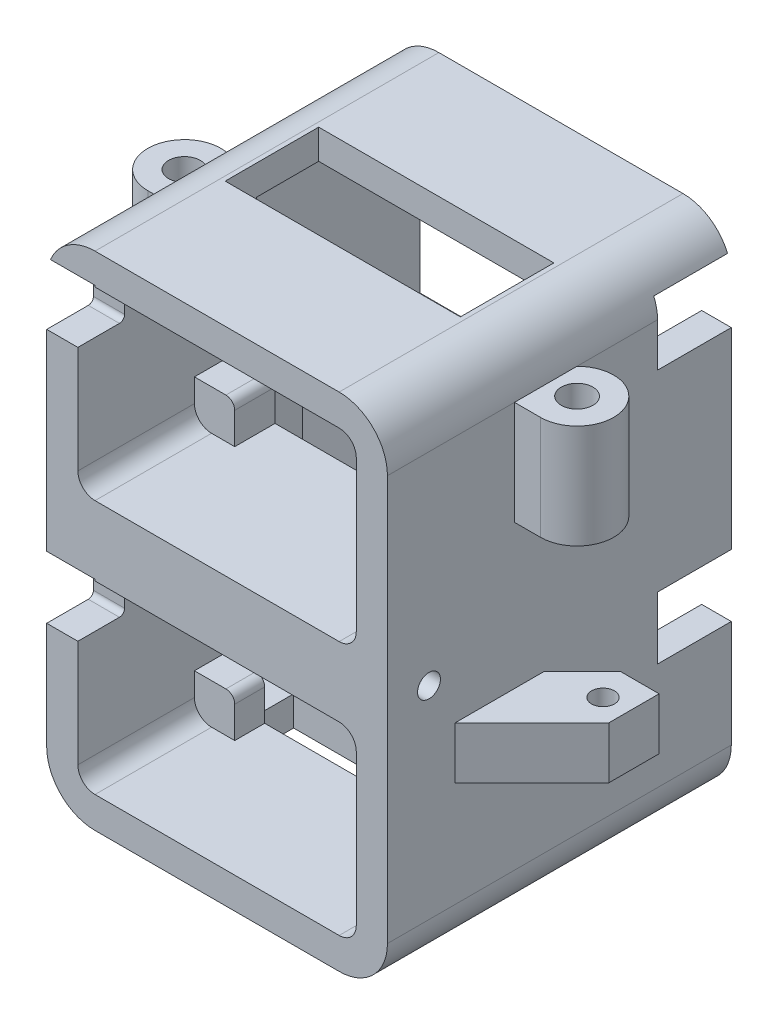
from build123d import *

# Parameters (mm, degrees)
EXTRUDE_2_DEPTH      = 11.22
EXTRUDE_3_DEPTH      = 3.88
CUT_EXTRUDE_1_DEPTH  = 4.65
SKETCH_8_R           = 3.525
SKETCH_8_R_2         = 1.525
EXTRUDE_5_DEPTH      = 10
SKETCH_9_W           = 22.64
SKETCH_9_H           = 3
CUT_EXTRUDE_3_DEPTH  = 3
SKETCH_10_W          = 21.46
SKETCH_10_H          = 6.88
CUT_EXTRUDE_4_DEPTH  = 1
SKETCH_11_R          = 1.1
EXTRUDE_6_DEPTH      = 5
SKETCH_12_R          = 1.1
CUT_EXTRUDE_5_DEPTH  = 8
CUT_EXTRUDE_START    = -8
SKETCH_13_R          = 1.1
CUT_EXTRUDE_6_DEPTH  = 8
SKETCH_14_W          = 6.52
SKETCH_14_H          = 9.58
EXTRUDE_7_DEPTH      = 3
SKETCH_15_W          = 27.1
SKETCH_15_H          = 42.6
EXTRUDE_8_DEPTH      = 18
SKETCH_16_W          = 27.1
SKETCH_16_H          = 6.4
EXTRUDE_9_DEPTH      = 15
CUT_EXTRUDE_8_REACH  = 51.09
CUT_EXTRUDE_9_REACH  = 62.949
SKETCH_18_W          = 7.1
SKETCH_18_H          = 6
CUT_EXTRUDE_START_2  = -2.85
SKETCH_19_W          = 21.46
SKETCH_19_H          = 1
SKETCH_19_H_2        = 3
CUT_EXTRUDE_10_DEPTH = 2.85
CUT_EXTRUDE_11_REACH = 65.204
SKETCH_20_W          = 22.64
SKETCH_20_H          = 6


with BuildPart() as part:
    # 草图2 → 凸台-拉伸2 (new body)
    with BuildSketch(Plane.XY):
        with BuildLine():
            ThreePointArc((-16.4, -7.25), (-15.038046533, -10.538046533), (-11.75, -11.9))
            Line((-11.75, -11.9), (11.75, -11.9))
            ThreePointArc((11.75, -11.9), (15.038046533, -10.538046533), (16.4, -7.25))
            Line((16.4, -7.25), (16.4, 31.75))
            ThreePointArc((16.4, 31.75), (15.038046533, 35.038046533), (11.75, 36.4))
            Line((11.75, 36.4), (-11.75, 36.4))
            ThreePointArc((-11.75, 36.4), (-15.038046533, 35.038046533), (-16.4, 31.75))
            Line((-16.4, 31.75), (-16.4, -7.25))
        make_face()
        with BuildLine():
            Line((13.4, 7.25), (13.4, -7.25))
            ThreePointArc((13.4, -7.25), (12.916726189, -8.416726189), (11.75, -8.9))
            Line((11.75, -8.9), (-11.75, -8.9))
            ThreePointArc((-11.75, -8.9), (-12.916726189, -8.416726189), (-13.4, -7.25))
            Line((-13.4, -7.25), (-13.4, 7.25))
            ThreePointArc((-13.4, 7.25), (-12.916726189, 8.416726189), (-11.75, 8.9))
            Line((-11.75, 8.9), (11.75, 8.9))
            ThreePointArc((11.75, 8.9), (12.916726189, 8.416726189), (13.4, 7.25))
        make_face(mode=Mode.SUBTRACT)
        with BuildLine():
            Line((-11.75, 33.4), (11.75, 33.4))
            ThreePointArc((11.75, 33.4), (12.916726189, 32.916726189), (13.4, 31.75))
            Line((13.4, 31.75), (13.4, 17.25))
            ThreePointArc((13.4, 17.25), (12.916726189, 16.083273811), (11.75, 15.6))
            Line((11.75, 15.6), (-11.75, 15.6))
            ThreePointArc((-11.75, 15.6), (-12.916726189, 16.083273811), (-13.4, 17.25))
            Line((-13.4, 17.25), (-13.4, 31.75))
            ThreePointArc((-13.4, 31.75), (-12.916726189, 32.916726189), (-11.75, 33.4))
        make_face(mode=Mode.SUBTRACT)
    extrude(amount=-EXTRUDE_2_DEPTH)

    # 草图3 → 凸台-拉伸3 (add)
    with BuildSketch(Plane(origin=(0, 0, -11.22), x_dir=(-1, 0, 0), z_dir=(0, 0, -1))):
        with BuildLine():
            ThreePointArc((11.75, -11.9), (15.038046533, -10.538046533), (16.4, -7.25))
            Line((16.4, -7.25), (16.4, 31.75))
            ThreePointArc((16.4, 31.75), (15.038046533, 35.038046533), (11.75, 36.4))
            Line((11.75, 36.4), (-11.75, 36.4))
            ThreePointArc((-11.75, 36.4), (-15.038046533, 35.038046533), (-16.4, 31.75))
            Line((-16.4, 31.75), (-16.4, -7.25))
            ThreePointArc((-16.4, -7.25), (-15.038046533, -10.538046533), (-11.75, -11.9))
            Line((-11.75, -11.9), (11.75, -11.9))
        make_face()
        with BuildLine():
            Line((13.4, -5.02), (10.37, -5.02))
            ThreePointArc((10.37, -5.02), (9.768959236, -5.268959236), (9.52, -5.87))
            Line((9.52, -5.87), (9.52, -8.9))
            Line((9.52, -8.9), (-9.52, -8.9))
            Line((-9.52, -8.9), (-9.52, -5.87))
            ThreePointArc((-9.52, -5.87), (-9.768959236, -5.268959236), (-10.37, -5.02))
            Line((-10.37, -5.02), (-13.4, -5.02))
            Line((-13.4, -5.02), (-13.4, 6.82))
            Line((-13.4, 6.82), (-11.67, 6.82))
            ThreePointArc((-11.67, 6.82), (-11.422512627, 6.922512627), (-11.32, 7.17))
            Line((-11.32, 7.17), (-11.32, 8.9))
            Line((-11.32, 8.9), (11.32, 8.9))
            Line((11.32, 8.9), (11.32, 7.17))
            ThreePointArc((11.32, 7.17), (11.422512627, 6.922512627), (11.67, 6.82))
            Line((11.67, 6.82), (13.4, 6.82))
            Line((13.4, 6.82), (13.4, -5.02))
        make_face(mode=Mode.SUBTRACT)
        with BuildLine():
            Line((13.4, 31.32), (13.4, 19.48))
            Line((13.4, 19.48), (10.37, 19.48))
            ThreePointArc((10.37, 19.48), (9.768959236, 19.231040764), (9.52, 18.63))
            Line((9.52, 18.63), (9.52, 15.6))
            Line((9.52, 15.6), (-9.52, 15.6))
            Line((-9.52, 15.6), (-9.52, 18.63))
            ThreePointArc((-9.52, 18.63), (-9.768959236, 19.231040764), (-10.37, 19.48))
            Line((-10.37, 19.48), (-13.4, 19.48))
            Line((-13.4, 19.48), (-13.4, 31.32))
            Line((-13.4, 31.32), (-11.67, 31.32))
            ThreePointArc((-11.67, 31.32), (-11.422512627, 31.422512627), (-11.32, 31.67))
            Line((-11.32, 31.67), (-11.32, 33.4))
            Line((-11.32, 33.4), (11.32, 33.4))
            Line((11.32, 33.4), (11.32, 31.67))
            ThreePointArc((11.32, 31.67), (11.422512627, 31.422512627), (11.67, 31.32))
            Line((11.67, 31.32), (13.4, 31.32))
        make_face(mode=Mode.SUBTRACT)
    extrude(amount=EXTRUDE_3_DEPTH)

    # 草图4 → 切除-拉伸1 (cut)
    with BuildSketch(Plane.ZY.offset(16.4)):
        with BuildLine():
            Line((0.3, 9.05), (-4, 9.05))
            ThreePointArc((-4, 9.05), (-4.353553391, 8.903553391), (-4.5, 8.55))
            Line((-4.5, 8.55), (-4.5, 3.55))
            ThreePointArc((-4.5, 3.55), (-4.353553391, 3.196446609), (-4, 3.05))
            Line((-4, 3.05), (0.3, 3.05))
            Line((0.3, 3.05), (0.3, 9.05))
        make_face()
        with BuildLine():
            Line((0.3, 33.55), (-4, 33.55))
            ThreePointArc((-4, 33.55), (-4.353553391, 33.403553391), (-4.5, 33.05))
            Line((-4.5, 33.05), (-4.5, 28.05))
            ThreePointArc((-4.5, 28.05), (-4.353553391, 27.696446609), (-4, 27.55))
            Line((-4, 27.55), (0.3, 27.55))
            Line((0.3, 27.55), (0.3, 33.55))
        make_face()
    extrude(amount=-CUT_EXTRUDE_1_DEPTH, mode=Mode.SUBTRACT)

    # 草图8 → 凸台-拉伸5 (add)
    # profile 1 of 2: a face of its own
    with BuildSketch(Plane(origin=(0, 31.75, 0), x_dir=(1, 0, 0), z_dir=(0, 1, 0))):
        with Locations((18.9, 15.755)):
            Circle(SKETCH_8_R)
        with Locations(Location((18.9, 15.755, 0), (0, 0, 270))):
            Circle(SKETCH_8_R_2, mode=Mode.SUBTRACT)
    # profile 2 of 2: a face of its own
    with BuildSketch(Plane(origin=(0, 31.75, 0), x_dir=(1, 0, 0), z_dir=(0, 1, 0))):
        with BuildLine():
            Line((15.375, 12.23), (18.9, 12.23))
            ThreePointArc((18.9, 12.23), (16.407448596, 13.262448596), (15.375, 15.755))
            Line((15.375, 15.755), (15.375, 12.23))
        make_face()
    extrude_5 = extrude(amount=-EXTRUDE_5_DEPTH)

    # 镜向1: 凸台-拉伸5 across plane
    add(extrude_5.mirror(Plane(origin=(0, 0, 0), x_dir=(0, 0, 1), z_dir=(1, 0, 0))))

    # 草图9 → 切除-拉伸3 (cut)
    with BuildSketch(Plane(origin=(0, 0, -15.1), x_dir=(-1, 0, 0), z_dir=(0, 0, -1))):
        with Locations((0, 34.9)):
            Rectangle(SKETCH_9_W, SKETCH_9_H)
    extrude(amount=-CUT_EXTRUDE_3_DEPTH, mode=Mode.SUBTRACT)

    # 草图10 → 切除-拉伸4 (cut)
    with BuildSketch(Plane(origin=(0, 0, -15.1), x_dir=(-1, 0, 0), z_dir=(0, 0, -1))):
        with Locations((0, -8.46)):
            Rectangle(SKETCH_10_W, SKETCH_10_H)
    extrude(amount=-CUT_EXTRUDE_4_DEPTH, mode=Mode.SUBTRACT)

    # 草图11 → 凸台-拉伸6 (add)
    with BuildSketch(Plane(origin=(0, 2.890336251, 0), x_dir=(1, 0, 0), z_dir=(0, 1, 0))):
        Polygon((23.795757056, 13.912359313), (23.795757056, 18.755), (20.055, 18.755), (16.4, 15.1), (16.4, 6.516602257), align=None)
        with Locations(Location((21.395757056, 15.755, 0), (0, 0, 180))):
            Circle(SKETCH_11_R, mode=Mode.SUBTRACT)
    extrude(amount=EXTRUDE_6_DEPTH)

    # 草图12 → 切除-拉伸5 (cut)
    with BuildSketch(Plane.ZY.offset(16.4)):
        with Locations((-4, 12.25)):
            Circle(SKETCH_12_R)
    extrude(amount=-CUT_EXTRUDE_5_DEPTH, mode=Mode.SUBTRACT)

    # 草图13 → 切除-拉伸6 (cut)
    with BuildSketch(Plane(origin=(16.4, 0, 0), x_dir=(0, 0, -1), z_dir=(1, 0, 0)).offset(CUT_EXTRUDE_START)):
        with Locations(Location((4, 12.25, 0), (0, 0, 180))):
            Circle(SKETCH_13_R)
    extrude(amount=CUT_EXTRUDE_6_DEPTH, mode=Mode.SUBTRACT)

    # 草图14 → 凸台-拉伸7 (add)
    with BuildSketch(Plane(origin=(0, 0, -15.1), x_dir=(-1, 0, 0), z_dir=(0, 0, -1))):
        with Locations((-13.14, 13.84)):
            Rectangle(SKETCH_14_W, SKETCH_14_H)
        with Locations((13.14, 13.84)):
            Rectangle(SKETCH_14_W, SKETCH_14_H)
    extrude(amount=EXTRUDE_7_DEPTH)

    # 草图15 → 凸台-拉伸8 (add)
    with BuildSketch(Plane(origin=(0, 0, -15.1), x_dir=(-1, 0, 0), z_dir=(0, 0, -1))):
        with BuildLine():
            Line((16.4, 9.05), (16.4, 18.63))
            Line((16.4, 18.63), (16.4, 31.75))
            ThreePointArc((16.4, 31.75), (15.038046533, 35.038046533), (11.75, 36.4))
            Line((11.75, 36.4), (-11.75, 36.4))
            ThreePointArc((-11.75, 36.4), (-15.038046533, 35.038046533), (-16.4, 31.75))
            Line((-16.4, 31.75), (-16.4, 21.75))
            Line((-16.4, 21.75), (-16.4, 18.63))
            Line((-16.4, 18.63), (-16.4, 9.05))
            Line((-16.4, 9.05), (-16.4, 2.890336251))
            Line((-16.4, 2.890336251), (-16.4, -7.25))
            ThreePointArc((-16.4, -7.25), (-15.038046533, -10.538046533), (-11.75, -11.9))
            Line((-11.75, -11.9), (11.75, -11.9))
            ThreePointArc((11.75, -11.9), (15.038046533, -10.538046533), (16.4, -7.25))
            Line((16.4, -7.25), (16.4, 9.05))
        make_face()
        with Locations((0, 12.25)):
            Rectangle(SKETCH_15_W, SKETCH_15_H, mode=Mode.SUBTRACT)
    extrude(amount=EXTRUDE_8_DEPTH)

    # 草图16 → 凸台-拉伸9 (add)
    with BuildSketch(Plane(origin=(0, 0, -18.1), x_dir=(-1, 0, 0), z_dir=(0, 0, -1))):
        with Locations((0, 12.25)):
            Rectangle(SKETCH_16_W, SKETCH_16_H)
    extrude(amount=EXTRUDE_9_DEPTH)

    # 草图17 → 切除-拉伸8 (cut, up to next)
    with BuildSketch(Plane.XZ.offset(-9.05), mode=Mode.PRIVATE) as cut_extrude_8_sk1:
        Polygon((-9.88, -18.1), (0, -27.98), (9.88, -18.1), align=None)
    cut_extrude_8_tool1 = extrude(cut_extrude_8_sk1.sketch, amount=-CUT_EXTRUDE_8_REACH, mode=Mode.PRIVATE) & part.part
    add(cut_extrude_8_tool1.solids().sort_by_distance((0, 9.05, -21.393333))[0], mode=Mode.SUBTRACT)

    # 草图18 → 切除-拉伸9 (cut, up to next)
    with BuildSketch(Plane.ZY.offset(-13.55), mode=Mode.PRIVATE) as cut_extrude_9_sk1:
        with Locations((-29.55, 6.05)):
            Rectangle(SKETCH_18_W, SKETCH_18_H)
    cut_extrude_9_tool1 = extrude(cut_extrude_9_sk1.sketch, amount=-CUT_EXTRUDE_9_REACH, mode=Mode.PRIVATE) & part.part
    # 草图18 → 切除-拉伸9 (cut, up to next)
    with BuildSketch(Plane.ZY.offset(-13.55), mode=Mode.PRIVATE) as cut_extrude_9_sk2:
        with Locations((-29.55, 30.55)):
            Rectangle(SKETCH_18_W, SKETCH_18_H)
    cut_extrude_9_tool2 = extrude(cut_extrude_9_sk2.sketch, amount=-CUT_EXTRUDE_9_REACH, mode=Mode.PRIVATE) & part.part
    add(cut_extrude_9_tool1.solids().sort_by_distance((13.55, 6.05, -29.55))[0], mode=Mode.SUBTRACT)
    add(cut_extrude_9_tool2.solids().sort_by_distance((13.55, 30.55, -29.55))[0], mode=Mode.SUBTRACT)

    # 草图19 → 切除-拉伸10 (cut)
    with BuildSketch(Plane.XZ.offset(11.9).offset(CUT_EXTRUDE_START_2)):
        with Locations((0, -14.6)):
            Rectangle(SKETCH_19_W, SKETCH_19_H)
        with Locations((0, -16.6)):
            Rectangle(SKETCH_19_W, SKETCH_19_H_2)
    extrude(amount=CUT_EXTRUDE_10_DEPTH, mode=Mode.SUBTRACT)

    # 草图20 → 切除-拉伸11 (cut, up to next)
    with BuildSketch(Plane(origin=(0, 36.4, 0), x_dir=(1, 0, 0), z_dir=(0, 1, 0)), mode=Mode.PRIVATE) as cut_extrude_11_sk1:
        with Locations((0, 18.1)):
            Rectangle(SKETCH_20_W, SKETCH_20_H)
    cut_extrude_11_tool1 = extrude(cut_extrude_11_sk1.sketch, amount=-CUT_EXTRUDE_11_REACH, mode=Mode.PRIVATE) & part.part
    add(cut_extrude_11_tool1.solids().sort_by_distance((0, 36.4, -18.1))[0], mode=Mode.SUBTRACT)


solid = part.part
